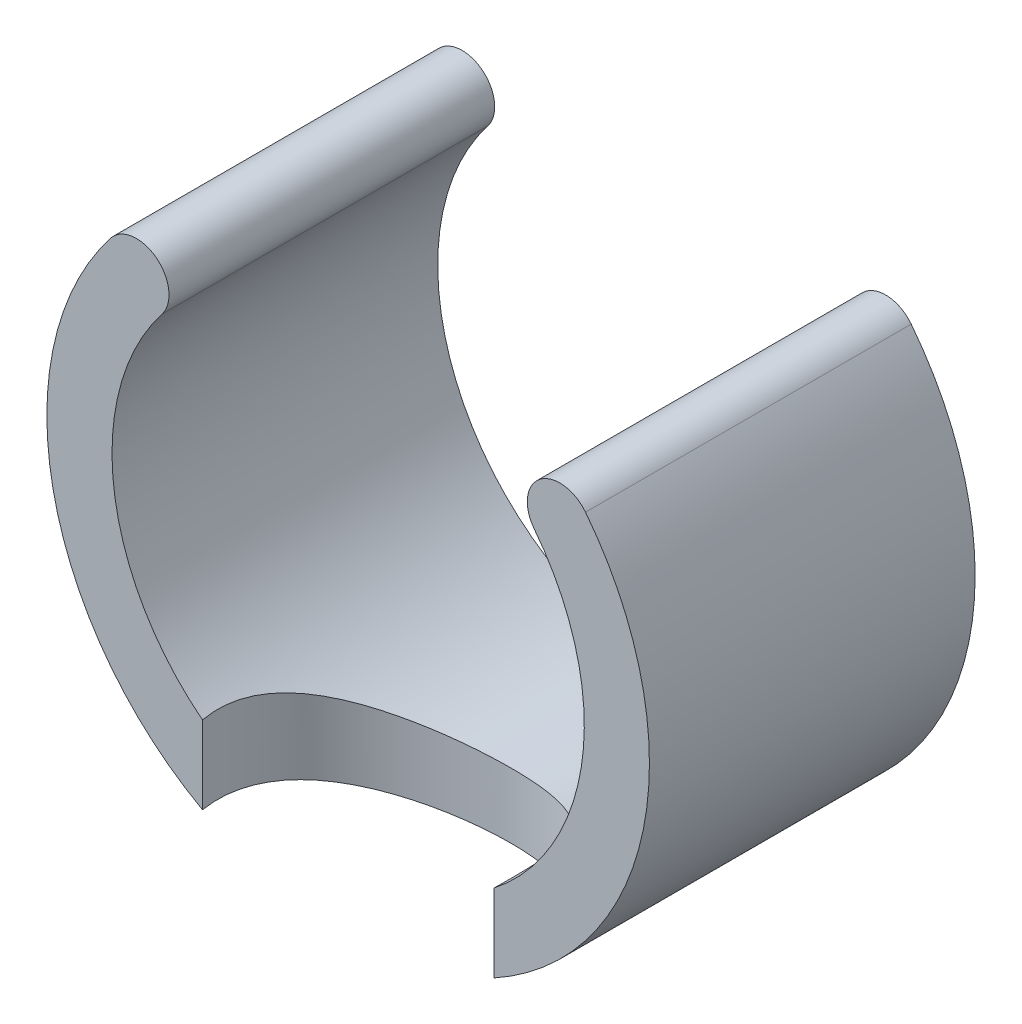
from build123d import *

# Parameters (mm, degrees)
EXTRUDE_569_DEPTH           = 10
CUT_EXTRUDE_2098_DEPTH      = 21.508286309
CUT_EXTRUDE_2098_DEPTH_BACK = 21.508286309
SKETCH_6_R                  = 4.5


with BuildPart() as part:
    # Эскиз1 → Extrude 569 (new body)
    with BuildSketch(Plane.XY):
        with BuildLine():
            ThreePointArc((-5.712121212, 4.464770012), (0, -7.25), (5.712121212, 4.464770012))
            ThreePointArc((5.712121212, 4.464770012), (5.884169654, 5.868479146), (7.287878788, 5.696430705))
            ThreePointArc((7.287878788, 5.696430705), (0, -9.25), (-7.287878788, 5.696430705))
            ThreePointArc((-7.287878788, 5.696430705), (-5.884169654, 5.868479146), (-5.712121212, 4.464770012))
        make_face()
    extrude(amount=EXTRUDE_569_DEPTH)

    # Эскиз6 → Cut-Extrude 2098 (cut, two sides: drawn at the far end of the back side and taken through both)
    with BuildSketch(Plane(origin=(0, -9.25, 0), x_dir=(-1, 0, 0), z_dir=(0, -1, 0)).offset(-CUT_EXTRUDE_2098_DEPTH_BACK)):
        with Locations((0, -9.5)):
            Circle(SKETCH_6_R)
    extrude(amount=CUT_EXTRUDE_2098_DEPTH + CUT_EXTRUDE_2098_DEPTH_BACK, mode=Mode.SUBTRACT)


solid = part.part
